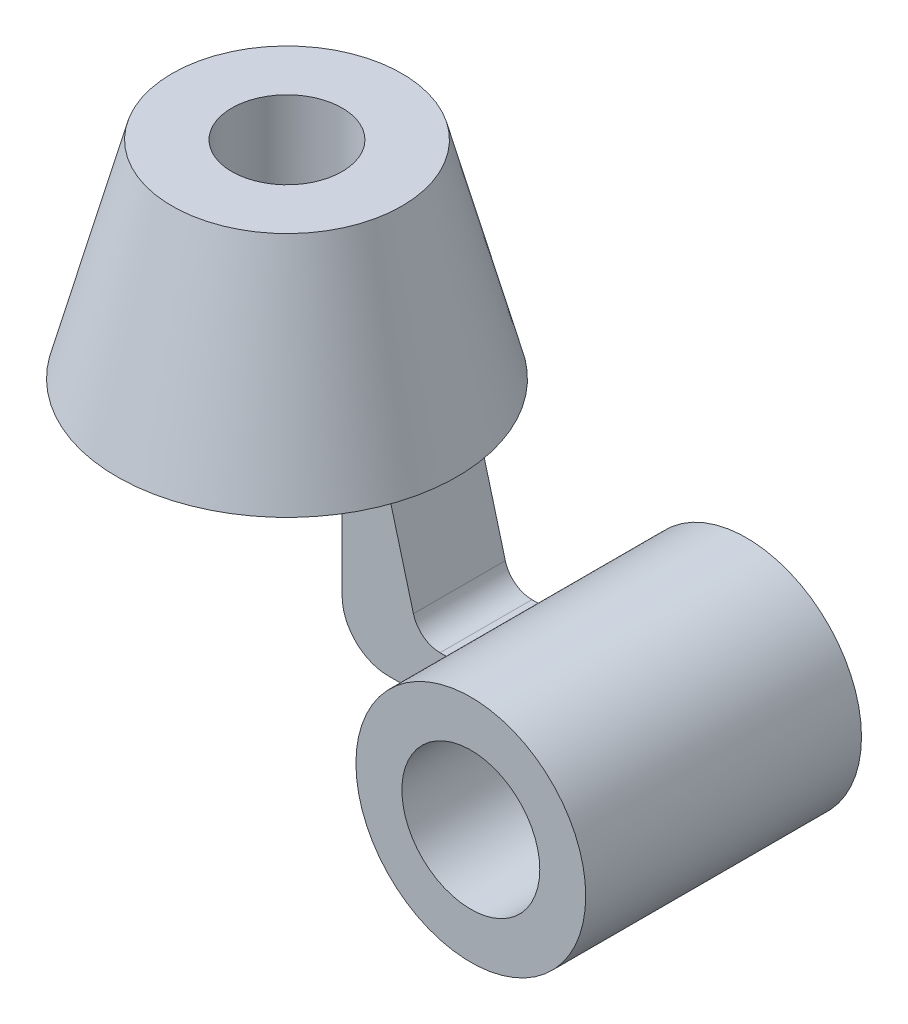
from build123d import *

# Parameters (mm, degrees)
BOSS_EXTRUDE1_DEPTH      = 30
BOSS_EXTRUDE1_DEPTH_BACK = 30
SKETCH2_R                = 25
BOSS_EXTRUDE2_DEPTH      = 10
BOSS_EXTRUDE2_DEPTH_BACK = 10
FILLET1_R                = 10
FILLET2_R                = 6
F_1_5MM_DOWEL_HOLE1_D    = 24
F_1_5MM_DOWEL_HOLE2_D    = 30


with BuildPart() as part:
    # Sketch1 → Revolve1 (revolve)
    with BuildSketch(Plane.XY):
        Polygon((0, 0), (37, 0), (25, 45), (0, 45), align=None)
    revolve(axis=Axis((0, 45, 0), (0, -1, 0)))



with BuildPart() as body_2:
    # Sketch2 → Boss-Extrude1 (new, two sides: drawn at the far end of the back side and taken through both)
    with BuildSketch(Plane.XY.offset(-BOSS_EXTRUDE1_DEPTH_BACK)):
        with Locations((70, -35)):
            Circle(SKETCH2_R)
    extrude(amount=BOSS_EXTRUDE1_DEPTH + BOSS_EXTRUDE1_DEPTH_BACK)


with BuildPart() as part_1:
    add(part.part)

    add(body_2.part)  # Boss-Extrude2 merges body 2
    # Sketch3 → Boss-Extrude2 (add, two sides: drawn at the far end of the back side and taken through both)
    with BuildSketch(Plane.XY.offset(-BOSS_EXTRUDE2_DEPTH_BACK)):
        Polygon((22, 0), (22, -35), (55.578502267, -35), (55.578502267, -25), (38.698729811, -25), (32, 0), align=None)
    extrude(amount=BOSS_EXTRUDE2_DEPTH + BOSS_EXTRUDE2_DEPTH_BACK)

    # Fillet1
    fillet1_edges = [part_1.edges().sort_by_distance(p)[0] for p in [
        (22, -35, 0),
    ]]
    fillet(fillet1_edges, radius=FILLET1_R)

    # Fillet2
    fillet2_edges = [part_1.edges().sort_by_distance(p)[0] for p in [
        (38.698729811, -25, 0),
    ]]
    fillet(fillet2_edges, radius=FILLET2_R)

    # Ø1.5mm Dowel Hole1 (through all)
    with Locations(Plane(origin=(0, 45, 0), x_dir=(1, 0, 0), z_dir=(0, 1, 0))):
        with Locations((0, 0)):
            Hole(F_1_5MM_DOWEL_HOLE1_D / 2)

    # Ø1.5mm Dowel Hole2 (through all)
    with Locations(Plane.XY.offset(30)):
        with Locations((70, -35)):
            Hole(F_1_5MM_DOWEL_HOLE2_D / 2)


solid = part_1.part
